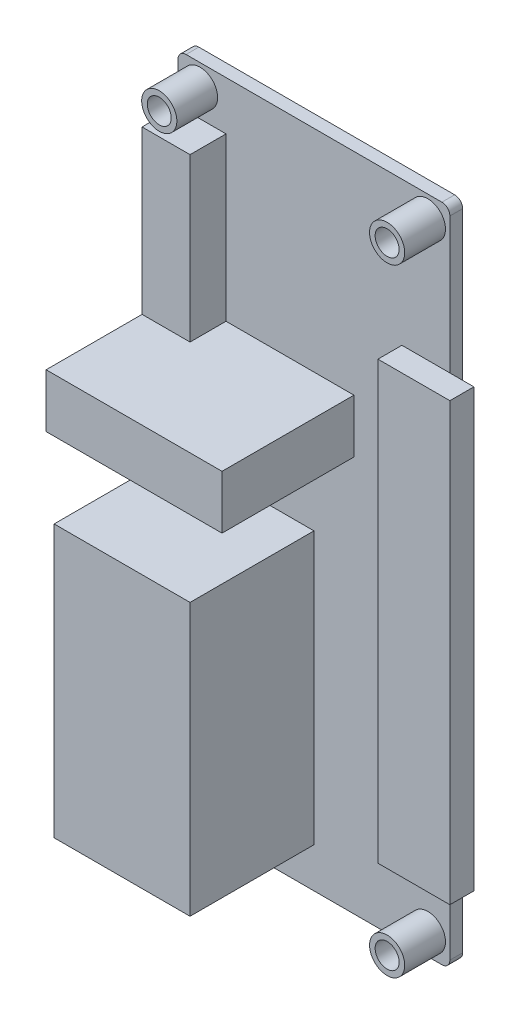
from build123d import *

# Parameters (mm, degrees)
SKETCH_2_R      = 1.5
EXTRUDE_1_DEPTH = 1.6
SKETCH_3_W      = 9
SKETCH_3_H      = 54.6
EXTRUDE_2_DEPTH = 3
SKETCH_4_W      = 17
SKETCH_4_H      = 34
EXTRUDE_3_DEPTH = 15.5
SKETCH_5_W      = 7
SKETCH_5_H      = 10.5
EXTRUDE_4_DEPTH = 3.5
SKETCH_6_R      = 2.2
SKETCH_6_R_2    = 1.5
EXTRUDE_5_DEPTH = 5.1
SKETCH_7_W      = 22
SKETCH_7_H      = 6.7
EXTRUDE_6_DEPTH = 16.5
SKETCH_8_W      = 6
SKETCH_8_H      = 20.3
EXTRUDE_7_DEPTH = 4.5


with BuildPart() as part:
    # 草图2 → 凸台-拉伸1 (new body)
    with BuildSketch(Plane.XY):
        with BuildLine():
            Line((-16, -41.3), (16, -41.3))
            ThreePointArc((16, -41.3), (16.707106781, -41.007106781), (17, -40.3))
            Line((17, -40.3), (17, 40.3))
            ThreePointArc((17, 40.3), (16.707106781, 41.007106781), (16, 41.3))
            Line((16, 41.3), (-16, 41.3))
            ThreePointArc((-16, 41.3), (-16.707106781, 41.007106781), (-17, 40.3))
            Line((-17, 40.3), (-17, -40.3))
            ThreePointArc((-17, -40.3), (-16.707106781, -41.007106781), (-16, -41.3))
        make_face()
        with Locations((-14.25, 38.6)):
            Circle(SKETCH_2_R, mode=Mode.SUBTRACT)
        with Locations((14.25, 38.6)):
            Circle(SKETCH_2_R, mode=Mode.SUBTRACT)
        with Locations((-14.25, -38.6)):
            Circle(SKETCH_2_R, mode=Mode.SUBTRACT)
        with Locations((14.25, -38.6)):
            Circle(SKETCH_2_R, mode=Mode.SUBTRACT)
    extrude(amount=EXTRUDE_1_DEPTH)

    # 草图3 → 凸台-拉伸2 (add)
    with BuildSketch(Plane.XY.offset(1.6)):
        with Locations((15.5, -4)):
            Rectangle(SKETCH_3_W, SKETCH_3_H)
    extrude(amount=EXTRUDE_2_DEPTH)

    # 草图4 → 凸台-拉伸3 (add)
    with BuildSketch(Plane.XY.offset(1.6)):
        with Locations((-8.5, -19.3)):
            Rectangle(SKETCH_4_W, SKETCH_4_H)
    extrude(amount=EXTRUDE_3_DEPTH)

    # 草图5 → 凸台-拉伸4 (add)
    with BuildSketch(Plane.XY.offset(1.6)):
        with Locations((-13.5, 2.95)):
            Rectangle(SKETCH_5_W, SKETCH_5_H)
    extrude(amount=EXTRUDE_4_DEPTH)

    # 草图6 → 凸台-拉伸5 (add)
    # profile 1 of 4: a face of its own
    with BuildSketch(Plane.XY.offset(1.6)):
        with Locations((-14.25, 38.6)):
            Circle(SKETCH_6_R)
        with Locations((-14.25, 38.6)):
            Circle(SKETCH_6_R_2, mode=Mode.SUBTRACT)
    # profile 2 of 4: a face of its own
    with BuildSketch(Plane.XY.offset(1.6)):
        with Locations((14.25, 38.6)):
            Circle(SKETCH_6_R)
        with Locations((14.25, 38.6)):
            Circle(SKETCH_6_R_2, mode=Mode.SUBTRACT)
    # profile 3 of 4: a face of its own
    with BuildSketch(Plane.XY.offset(1.6)):
        with Locations((-14.25, -38.6)):
            Circle(SKETCH_6_R)
        with Locations((-14.25, -38.6)):
            Circle(SKETCH_6_R_2, mode=Mode.SUBTRACT)
    # profile 4 of 4: a face of its own
    with BuildSketch(Plane.XY.offset(1.6)):
        with Locations((14.25, -38.6)):
            Circle(SKETCH_6_R)
        with Locations((14.25, -38.6)):
            Circle(SKETCH_6_R_2, mode=Mode.SUBTRACT)
    extrude(amount=EXTRUDE_5_DEPTH)

    # 草图7 → 凸台-拉伸6 (add)
    with BuildSketch(Plane.XY.offset(1.6)):
        with Locations((-6, 11.55)):
            Rectangle(SKETCH_7_W, SKETCH_7_H)
    extrude(amount=EXTRUDE_6_DEPTH)

    # 草图8 → 凸台-拉伸7 (add)
    with BuildSketch(Plane.XY.offset(1.6)):
        with Locations((-14, 25.05)):
            Rectangle(SKETCH_8_W, SKETCH_8_H)
    extrude(amount=EXTRUDE_7_DEPTH)


solid = part.part
